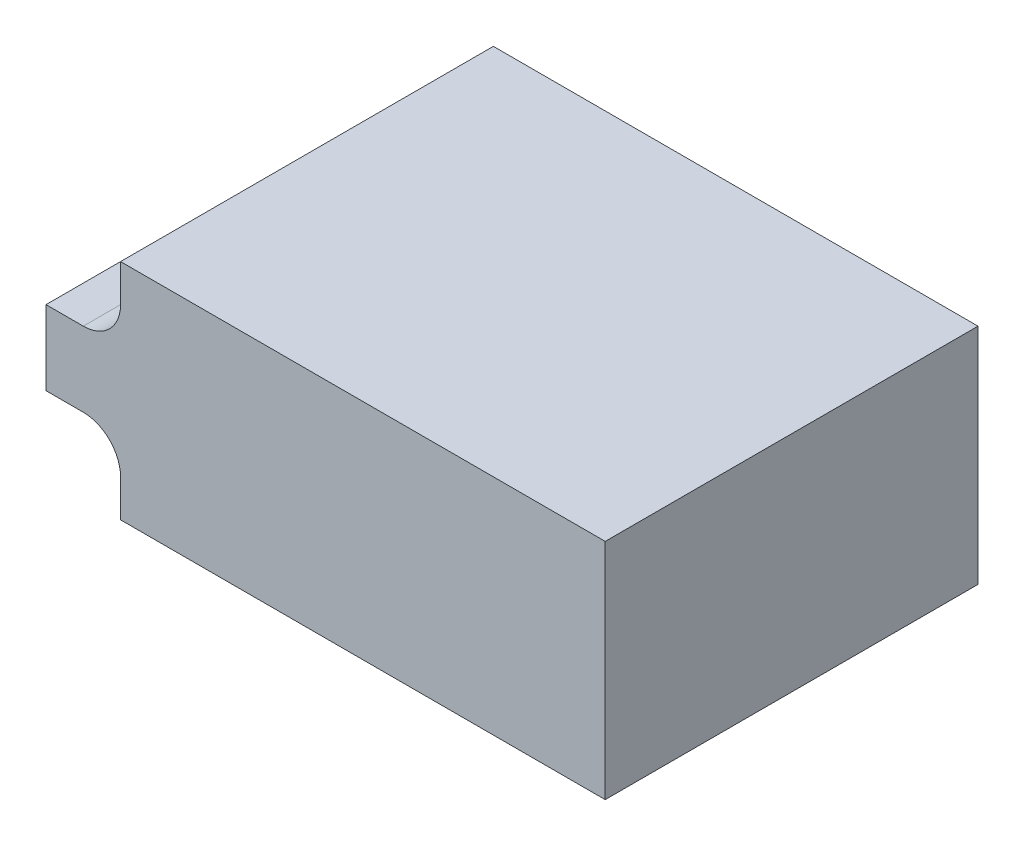
from build123d import *

# Parameters (mm, degrees)
ESQUISSE1_W             = 15
ESQUISSE1_H             = 6
BOSS_EXTRU_1_DEPTH      = 10
ESQUISSE2_W             = 2
ESQUISSE2_H             = 2
ENL_V_MAT_EXTRU_1_DEPTH = 13.854960132
CONG_1_R                = 1


with BuildPart() as part:
    # Esquisse1 → Boss.-Extru.1 (new body)
    with BuildSketch(Plane.XY):
        Rectangle(ESQUISSE1_W, ESQUISSE1_H)
    extrude(amount=BOSS_EXTRU_1_DEPTH)

    # Esquisse2 → Enlèv. mat.-Extru.1 (cut, through all)
    with BuildSketch(Plane(origin=(0, 0, 0), x_dir=(-1, 0, 0), z_dir=(0, 0, -1))):
        with Locations((6.5, 2)):
            Rectangle(ESQUISSE2_W, ESQUISSE2_H)
        with Locations((6.5, -2)):
            Rectangle(ESQUISSE2_W, ESQUISSE2_H)
    extrude(amount=-ENL_V_MAT_EXTRU_1_DEPTH, mode=Mode.SUBTRACT)

    # Congé1
    cong_1_edges = [part.edges().sort_by_distance(p)[0] for p in [
        (-5.5, 1, 5),
        (-5.5, -1, 5),
    ]]
    fillet(cong_1_edges, radius=CONG_1_R)


solid = part.part
